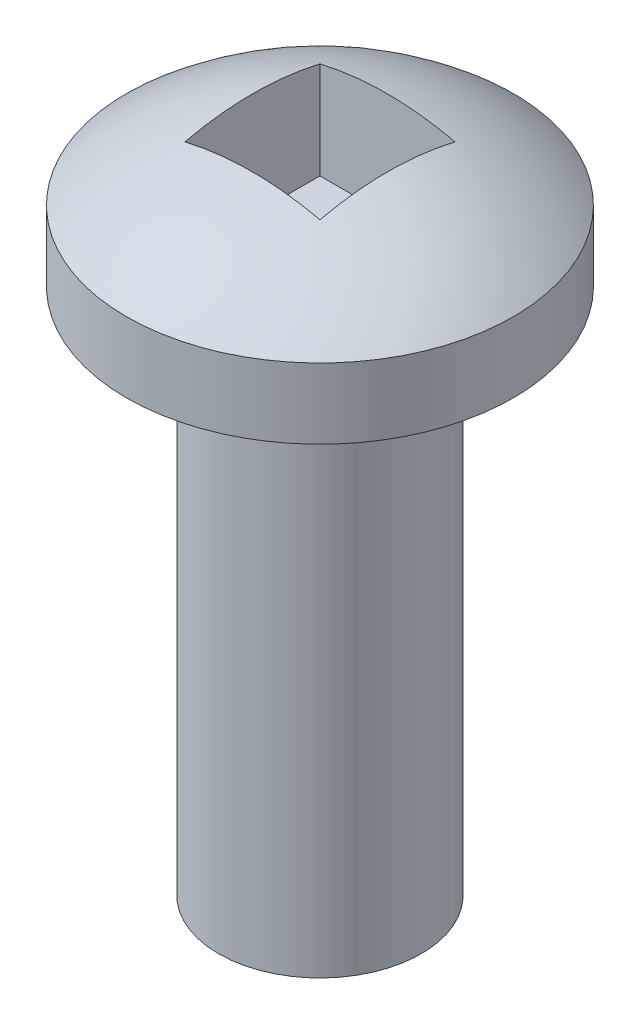
from build123d import *

# Parameters (mm, degrees)
SKETCH1_R           = 1.8288
BOSS_EXTRUDE1_DEPTH = 9.525
SKETCH2_R           = 3.4925
BOSS_EXTRUDE2_DEPTH = 1.27
DOME1_FACE_RADIUS   = 3.4925
DOME1_HEIGHT        = 1.27
SKETCH3_W           = 2.4384
SKETCH3_H           = 2.4384
CUT_EXTRUDE1_DEPTH  = 2.032


with BuildPart() as part:
    # Sketch1 → Boss-Extrude1 (new body)
    with BuildSketch(Plane(origin=(0, 0, 0), x_dir=(1, 0, 0), z_dir=(0, 1, 0))):
        with Locations(Location((0, 0, 0), (0, 0, 270))):
            Circle(SKETCH1_R)
    extrude(amount=-BOSS_EXTRUDE1_DEPTH)

    # Sketch2 → Boss-Extrude2 (add)
    with BuildSketch(Plane(origin=(0, 0, 0), x_dir=(1, 0, 0), z_dir=(0, 1, 0))):
        with Locations(Location((0, 0, 0), (0, 0, 270))):
            Circle(SKETCH2_R)
    extrude(amount=BOSS_EXTRUDE2_DEPTH)

    # Dome1: a dome of height H over a round flat face of radius A is a cap of a sphere of radius (A * A + H * H) / (2 * H)
    dome1_r = (DOME1_FACE_RADIUS * DOME1_FACE_RADIUS + DOME1_HEIGHT * DOME1_HEIGHT) / (2 * DOME1_HEIGHT)
    dome1_base = Plane((0, 1.27, 0), z_dir=(0, 1, 0))
    with Locations(dome1_base.offset(DOME1_HEIGHT - dome1_r)):
        dome1_ball = Sphere(dome1_r, mode=Mode.PRIVATE)
    add(split(dome1_ball, bisect_by=dome1_base, keep=Keep.TOP, mode=Mode.PRIVATE))

    # Sketch3 → Cut-Extrude1 (cut)
    with BuildSketch(Plane(origin=(0, 2.54, 0), x_dir=(1, 0, 0), z_dir=(0, 1, 0))):
        Rectangle(SKETCH3_W, SKETCH3_H)
    extrude(amount=-CUT_EXTRUDE1_DEPTH, mode=Mode.SUBTRACT)


solid = part.part
